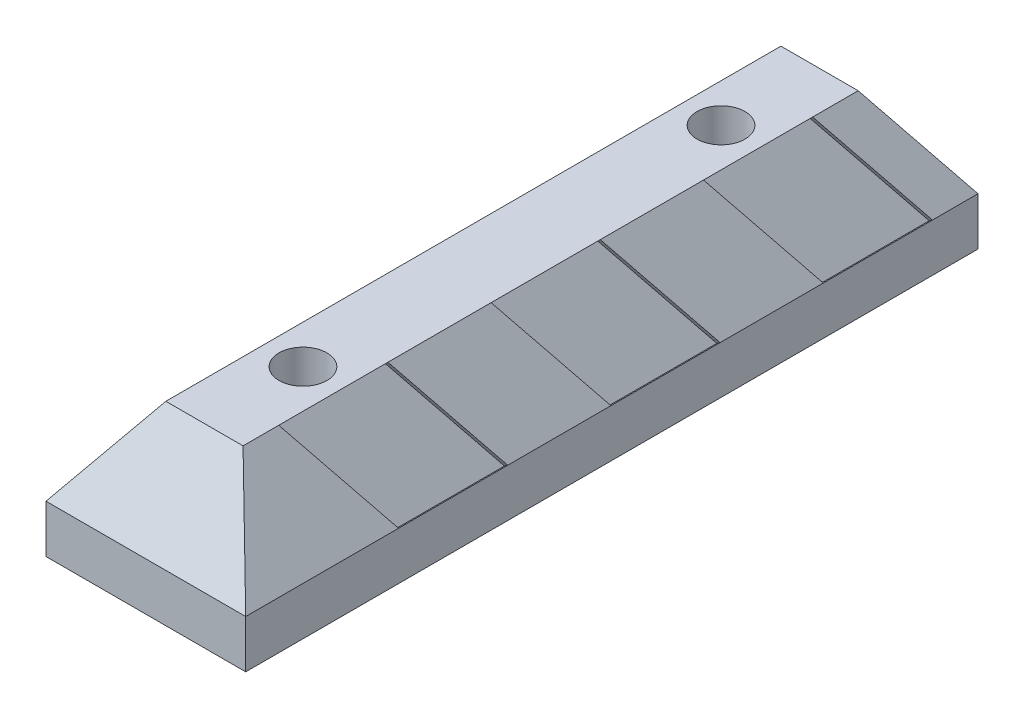
from build123d import *

# Parameters (mm, degrees)
CROQUIS1_W              = 150
CROQUIS1_H              = 102
SALIENTE_EXTRUIR1_DEPTH = 550
CORTAR_EXTRUIR1_DEPTH   = 550
CORTAR_EXTRUIR2_DEPTH   = 500
CORTAR_EXTRUIR3_DEPTH   = 3
CORTAR_EXTRUIR4_DEPTH   = 3
CROQUIS6_R              = 6.35
CORTAR_EXTRUIR5_DEPTH   = 102
CROQUIS7_R              = 18
CORTAR_EXTRUIR6_DEPTH   = 41


with BuildPart() as part:
    # Croquis1 → Saliente-Extruir1 (new body)
    with BuildSketch(Plane.XY):
        with Locations((75, 51)):
            Rectangle(CROQUIS1_W, CROQUIS1_H)
    extrude(amount=SALIENTE_EXTRUIR1_DEPTH)

    # Croquis2 → Cortar-Extruir1 (cut)
    with BuildSketch(Plane.XY.offset(550)):
        Polygon((0, 36), (46, 102), (-6.726685703, 105.184971584), align=None)
        Polygon((150, 36), (104, 102), (154.547307418, 106.586000482), align=None)
    extrude(amount=-CORTAR_EXTRUIR1_DEPTH, mode=Mode.SUBTRACT)

    # Croquis3 → Cortar-Extruir2 (cut)
    with BuildSketch(Plane.ZY):
        Polygon((0, 36), (44, 102), (0, 102), align=None)
        Polygon((550, 36), (506, 102), (550, 102), align=None)
    extrude(amount=-CORTAR_EXTRUIR2_DEPTH, mode=Mode.SUBTRACT)

    # Croquis4 → Cortar-Extruir3 (cut)
    with BuildSketch(Plane(origin=(-16.887515451, 11.770086527, 0), x_dir=(0, 0, 1), z_dir=(-0.8203981667699868, 0.5717926616881726, 0))):
        Polygon((34.193877534, 29.534334004), (78.193877534, 109.983075448), (160.193877534, 109.983075448), (116.193877534, 29.534334004), align=None)
        Polygon((193.699999945, 29.534334004), (237.699999945, 109.983075448), (319.699999945, 109.983075448), (275.699999945, 29.534334004), align=None)
        Polygon((353.206122355, 29.534334004), (397.206122355, 109.983075448), (479.206122355, 109.983075448), (435.206122355, 29.534334004), align=None)
    extrude(amount=-CORTAR_EXTRUIR3_DEPTH, mode=Mode.SUBTRACT)

    # Croquis5 → Cortar-Extruir4 (cut)
    with BuildSketch(Plane(origin=(117.845488257, 82.13473424, 0), x_dir=(0, 0, -1), z_dir=(0.8203981667699864, 0.5717926616881731, 0))):
        Polygon((-78.193877534, 24.214176195), (-34.193877534, -56.23456525), (-116.193877534, -56.23456525), (-160.193877534, 24.214176195), align=None)
        Polygon((-193.699999945, -56.23456525), (-237.699999945, 24.214176195), (-319.699999945, 24.214176195), (-275.699999945, -56.23456525), align=None)
        Polygon((-397.206122355, 24.214176195), (-353.206122355, -56.23456525), (-435.206122355, -56.23456525), (-479.206122355, 24.214176195), align=None)
    extrude(amount=-CORTAR_EXTRUIR4_DEPTH, mode=Mode.SUBTRACT)

    # Croquis6 → Cortar-Extruir5 (cut)
    with BuildSketch(Plane(origin=(0, 102, 0), x_dir=(1, 0, 0), z_dir=(0, 1, 0))):
        with Locations(Location((75, -118, 0), (0, 0, 270))):
            Circle(CROQUIS6_R)
        with Locations(Location((75, -432, 0), (0, 0, 270))):
            Circle(CROQUIS6_R)
    extrude(amount=-CORTAR_EXTRUIR5_DEPTH, mode=Mode.SUBTRACT)

    # Croquis7 → Cortar-Extruir6 (cut)
    with BuildSketch(Plane(origin=(0, 102, 0), x_dir=(1, 0, 0), z_dir=(0, 1, 0))):
        with Locations(Location((75, -118, 0), (0, 0, 270))):
            Circle(CROQUIS7_R)
        with Locations(Location((75, -432, 0), (0, 0, 270))):
            Circle(CROQUIS7_R)
    extrude(amount=-CORTAR_EXTRUIR6_DEPTH, mode=Mode.SUBTRACT)


solid = part.part
